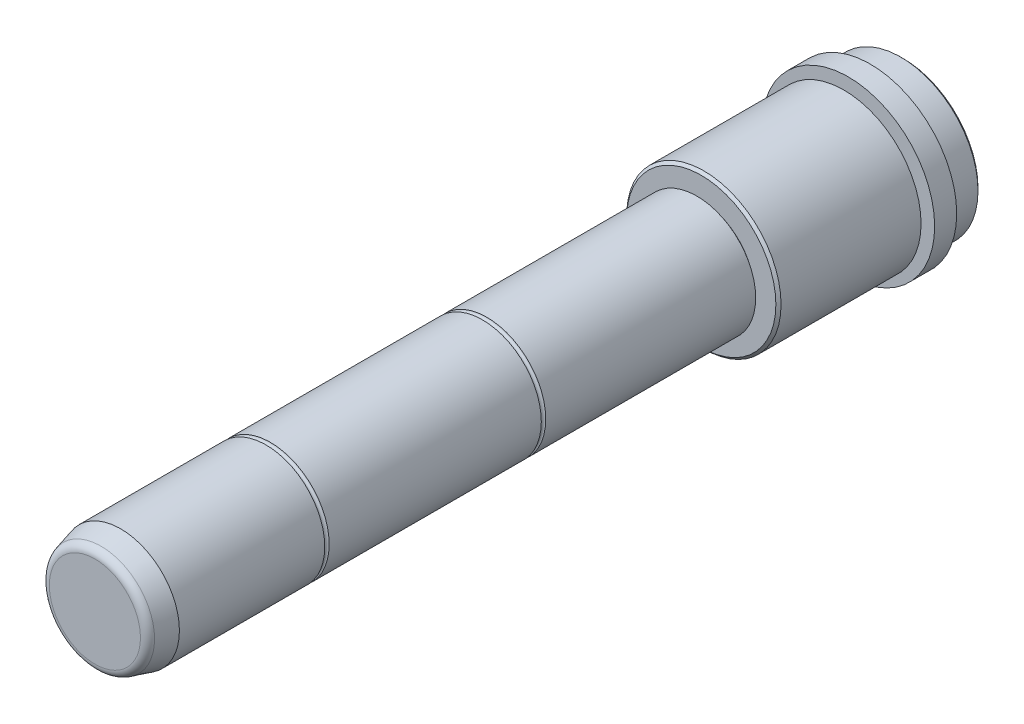
from build123d import *

# Parameters (mm, degrees)
SZKIC1_W = 9
SZKIC1_H = 21
SZKIC3_W = 1.2
SZKIC3_H = 2.1
SZKIC4_W = 6
SZKIC4_H = 23.5
SZKIC5_W = 40
SZKIC5_H = 21
SZKIC6_W = 1.2
SZKIC6_H = 2.1
SZKIC8_W = 165
SZKIC8_H = 16
SZKIC9_W = 1.2
SZKIC9_H = 1.6


with BuildPart() as part:
    # Szkic1 → Obrót1 (revolve)
    with BuildSketch(Plane(origin=(0, 0, 0), x_dir=(0, 0, -1), z_dir=(1, 0, 0))):
        with Locations((-4.5, 10.5)):
            Rectangle(SZKIC1_W, SZKIC1_H)
    revolve(axis=Axis((0, 0, 0), (0, 0, 1)))

    # Szkic2 → Wycięcie-obrót1 (revolve, cut)
    with BuildSketch(Plane(origin=(0, 0, 0), x_dir=(0, 0, -1), z_dir=(1, 0, 0))):
        Polygon((-0.707106781, 21), (0, 20.292893219), (0, 21), align=None)
    revolve(axis=Axis((0, 0, 0), (0, 0, 1)), mode=Mode.SUBTRACT)

    # Szkic3 → Wycięcie-obrót2 (revolve, cut)
    with BuildSketch(Plane(origin=(0, 0, 0), x_dir=(0, 0, -1), z_dir=(1, 0, 0))):
        with Locations((-8.4, 19.95)):
            Rectangle(SZKIC3_W, SZKIC3_H)
    revolve(axis=Axis((0, 0, 0), (0, 0, 1)), mode=Mode.SUBTRACT)

    # Szkic4 → Obrót2 (revolve)
    with BuildSketch(Plane(origin=(0, 0, 0), x_dir=(0, 0, -1), z_dir=(1, 0, 0))):
        with Locations((-12, 11.75)):
            Rectangle(SZKIC4_W, SZKIC4_H)
    revolve(axis=Axis((0, 0, 9), (0, 0, 1)))

    # Szkic5 → Obrót3 (revolve)
    with BuildSketch(Plane(origin=(0, 0, 0), x_dir=(0, 0, -1), z_dir=(1, 0, 0))):
        with Locations((-35, 10.5)):
            Rectangle(SZKIC5_W, SZKIC5_H)
    revolve(axis=Axis((0, 0, 15), (0, 0, 1)))

    # Szkic6 → Wycięcie-obrót3 (revolve, cut)
    with BuildSketch(Plane(origin=(0, 0, 0), x_dir=(0, 0, -1), z_dir=(1, 0, 0))):
        with Locations((-15.6, 19.95)):
            Rectangle(SZKIC6_W, SZKIC6_H)
    revolve(axis=Axis((0, 0, 15), (0, 0, 1)), mode=Mode.SUBTRACT)

    # Szkic7 → Wycięcie-obrót4 (revolve, cut)
    with BuildSketch(Plane(origin=(0, 0, 0), x_dir=(0, 0, -1), z_dir=(1, 0, 0))):
        Polygon((-55, 20.292893219), (-54.292893219, 21), (-55, 21), align=None)
    revolve(axis=Axis((0, 0, 9), (0, 0, 1)), mode=Mode.SUBTRACT)

    # Szkic8 → Obrót4 (revolve)
    with BuildSketch(Plane(origin=(0, 0, 0), x_dir=(0, 0, -1), z_dir=(1, 0, 0))):
        with Locations((-137.5, 8)):
            Rectangle(SZKIC8_W, SZKIC8_H)
    revolve(axis=Axis((0, 0, 55), (0, 0, 1)))

    # Szkic9 → Wycięcie-obrót5 (revolve, cut)
    with BuildSketch(Plane(origin=(0, 0, 0), x_dir=(0, 0, -1), z_dir=(1, 0, 0))):
        with Locations((-55.6, 15.2)):
            Rectangle(SZKIC9_W, SZKIC9_H)
    revolve(axis=Axis((0, 0, 55), (0, 0, 1)), mode=Mode.SUBTRACT)

    # Szkic10 → Wycięcie-obrót6 (revolve, cut)
    with BuildSketch(Plane(origin=(0, 0, 0), x_dir=(0, 0, -1), z_dir=(1, 0, 0))):
        Polygon((-220, 14.124355653), (-213, 16), (-220, 16), align=None)
    revolve(axis=Axis((0, 0, 55), (0, 0, 1)), mode=Mode.SUBTRACT)

    # Szkic11 → Wycięcie-obrót7 (revolve, cut)
    with BuildSketch(Plane(origin=(0, 0, 0), x_dir=(0, 0, -1), z_dir=(1, 0, 0))):
        with BuildLine():
            Line((-218.332342851, 14.571203039), (-220, 14.124355653))
            Line((-220, 14.124355653), (-220, 12.39786993))
            ThreePointArc((-220, 12.39786993), (-219.535045016, 13.767583145), (-218.332342851, 14.571203039))
        make_face()
    revolve(axis=Axis((0, 0, 55), (0, 0, 1)), mode=Mode.SUBTRACT)

    # Szkic12 → Wycięcie-obrót8 (revolve, cut)
    with BuildSketch(Plane(origin=(0, 0, 0), x_dir=(0, 0, -1), z_dir=(1, 0, 0))):
        with BuildLine():
            Line((-172.257142857, 16), (-173.457142857, 16))
            ThreePointArc((-173.457142857, 16), (-172.857142857, 15.4), (-172.257142857, 16))
        make_face()
    revolve(axis=Axis((0, 0, 172.257142857), (0, 0, 1)), mode=Mode.SUBTRACT)

    # Szkic13 → Wycięcie-obrót9 (revolve, cut)
    with BuildSketch(Plane(origin=(0, 0, 0), x_dir=(0, 0, -1), z_dir=(1, 0, 0))):
        with BuildLine():
            Line((-113.328570957, 16), (-114.528570957, 16))
            ThreePointArc((-114.528570957, 16), (-113.928570957, 15.4), (-113.328570957, 16))
        make_face()
    revolve(axis=Axis((0, 0, 113.328570957), (0, 0, 1)), mode=Mode.SUBTRACT)


solid = part.part
